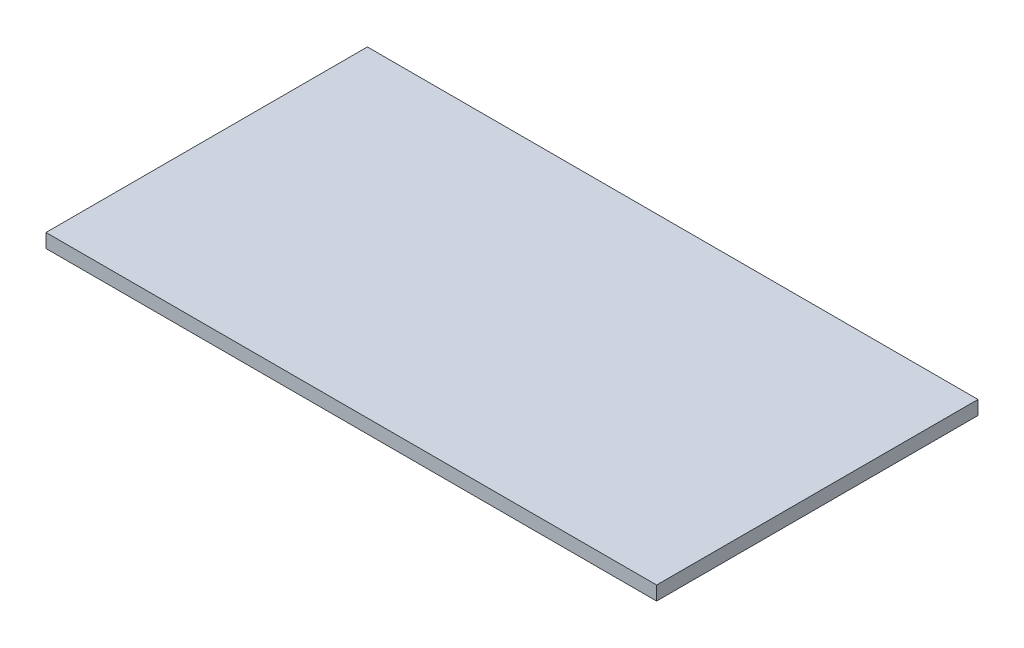
from build123d import *

# Parameters (mm, degrees)
SKETCH1_W           = 114
SKETCH1_H           = 60
BOSS_EXTRUDE1_DEPTH = 2.6


with BuildPart() as part:
    # Sketch1 → Boss-Extrude1 (new body)
    with BuildSketch(Plane(origin=(0, 0, 0), x_dir=(1, 0, 0), z_dir=(0, 1, 0))):
        Rectangle(SKETCH1_W, SKETCH1_H)
    extrude(amount=BOSS_EXTRUDE1_DEPTH)


solid = part.part
